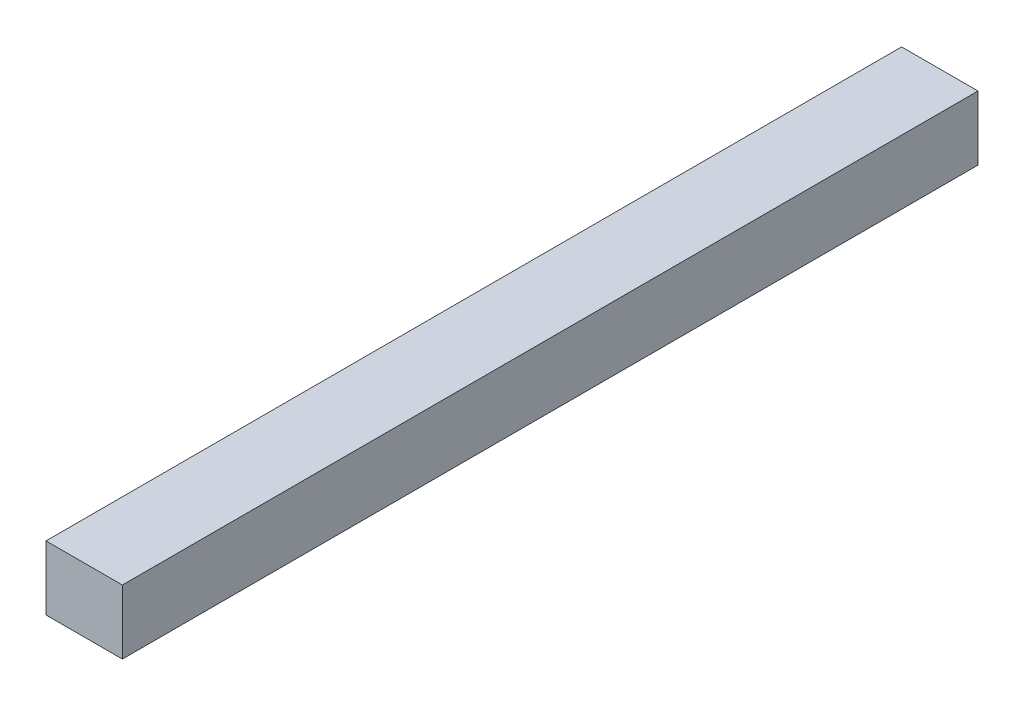
from build123d import *

# Parameters (mm, degrees)
ESQUISSE1_W        = 75
ESQUISSE1_H        = 63
BOSS_EXTRU_1_DEPTH = 840


with BuildPart() as part:
    # Esquisse1 → Boss.-Extru.1 (new body)
    with BuildSketch(Plane.XY):
        with Locations((37.5, 31.5)):
            Rectangle(ESQUISSE1_W, ESQUISSE1_H)
    extrude(amount=BOSS_EXTRU_1_DEPTH)


solid = part.part
